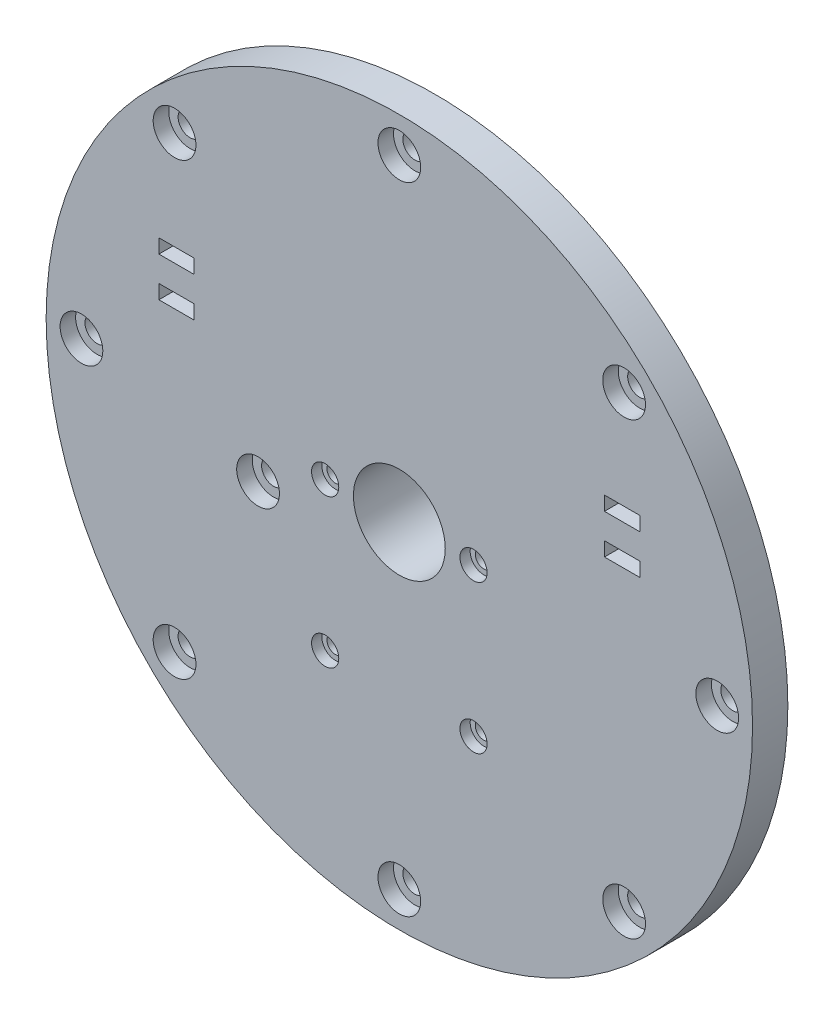
from build123d import *

# Parameters (mm, degrees)
SKETCH_1_R                   = 50
EXTRUDE_1_DEPTH              = 5
SKETCH_13_W                  = 26
SKETCH_13_H                  = 32.5
EXTRUDE_3_DEPTH              = 10
FILLET_2_R                   = 2.5
SKETCH_6_R                   = 6.5
CUT_EXTRUDE_1_DEPTH          = 73.284161474
HOLE_WIZARD_M2_1_D           = 2.4
HOLE_WIZARD_M2_1_CBORE_D     = 3.85
HOLE_WIZARD_M2_1_CBORE_DEPTH = 1.45
HOLE_WIZARD_M3_2_D           = 3.4
HOLE_WIZARD_M3_2_CBORE_D     = 6.05
HOLE_WIZARD_M3_2_CBORE_DEPTH = 2.2
PATTERN_CIRCULAR_1_COUNT     = 8
SKETCH_7_W                   = 3
SKETCH_7_H                   = 3
EXTRUDE_2_DEPTH              = 3
FILLET_1_R                   = 1
FILLET_1_OF_MIRROR_2_R       = 1
SKETCH_9_W                   = 5
SKETCH_9_H                   = 2
CUT_EXTRUDE_2_DEPTH          = 72.414284285
HOLE_WIZARD_M3_3_D           = 3.4
HOLE_WIZARD_M3_3_CBORE_D     = 6.05
HOLE_WIZARD_M3_3_CBORE_DEPTH = 2.2


with BuildPart() as part:
    # ｽｹｯﾁ1 → ﾎﾞｽ - 押し出し1 (new body)
    with BuildSketch(Plane.XY):
        Circle(SKETCH_1_R)
    extrude(amount=EXTRUDE_1_DEPTH)

    # ｽｹｯﾁ13 → ﾎﾞｽ - 押し出し3 (add)
    with BuildSketch(Plane(origin=(0, 0, 0), x_dir=(-1, 0, 0), z_dir=(0, 0, -1))):
        with Locations((0, -7.25)):
            Rectangle(SKETCH_13_W, SKETCH_13_H)
    extrude(amount=EXTRUDE_3_DEPTH)

    # ﾌｨﾚｯﾄ2
    fillet_2_edges = [part.edges().sort_by_distance(p)[0] for p in [
        (13, 9, -5),
        (13, -23.5, -5),
        (-13, -23.5, -5),
        (-13, 9, -5),
    ]]
    fillet(fillet_2_edges, radius=FILLET_2_R)

    # ｽｹｯﾁ6 → ｶｯﾄ - 押し出し1 (cut, through all)
    with BuildSketch(Plane.XY.offset(5)):
        Circle(SKETCH_6_R)
    extrude(amount=-CUT_EXTRUDE_1_DEPTH, mode=Mode.SUBTRACT)

    # M2 丸平ねじ用座ぐり穴1 (through all)
    with Locations(Plane.XY.offset(5)):
        with Locations((-10.5, 0), (-10.5, -21)):
            hole_wizard_m2_1 = CounterBoreHole(HOLE_WIZARD_M2_1_D / 2, HOLE_WIZARD_M2_1_CBORE_D / 2, HOLE_WIZARD_M2_1_CBORE_DEPTH)

    # ﾐﾗｰ1: M2 丸平ねじ用座ぐり穴1 across plane
    add(hole_wizard_m2_1.mirror(Plane(origin=(0, 0, 0), x_dir=(0, 0, 1), z_dir=(1, 0, 0))), mode=Mode.SUBTRACT)

    # M3 丸平ねじ用座ぐり穴2 (through all)
    with Locations(Plane.XY.offset(5)):
        with Locations((45, 0)):
            hole_wizard_m3_2 = CounterBoreHole(HOLE_WIZARD_M3_2_D / 2, HOLE_WIZARD_M3_2_CBORE_D / 2, HOLE_WIZARD_M3_2_CBORE_DEPTH)

    # 円形ﾊﾟﾀｰﾝ1: M3 丸平ねじ用座ぐり穴2 ×8 about axis
    pattern_circular_1_axis = Axis((0, 0, 0), (0, 0, 1))
    for i in range(1, PATTERN_CIRCULAR_1_COUNT):
        add(hole_wizard_m3_2.rotate(pattern_circular_1_axis, i * 360 / PATTERN_CIRCULAR_1_COUNT), mode=Mode.SUBTRACT)

    # ｽｹｯﾁ7 → ﾎﾞｽ - 押し出し2 (add)
    with BuildSketch(Plane(origin=(0, 0, 0), x_dir=(-1, 0, 0), z_dir=(0, 0, -1))):
        with Locations((36.535, 14.75)):
            Rectangle(SKETCH_7_W, SKETCH_7_H)
    extrude_2 = extrude(amount=EXTRUDE_2_DEPTH)

    # ﾌｨﾚｯﾄ1
    fillet_1_edges = [part.edges().sort_by_distance(p)[0] for p in [
        (-38.035, 14.75, 0),
    ]]
    fillet(fillet_1_edges, radius=FILLET_1_R)

    # ﾐﾗｰ2: ﾎﾞｽ - 押し出し2 across plane
    add(extrude_2.mirror(Plane(origin=(0, 0, 0), x_dir=(0, 0, 1), z_dir=(1, 0, 0))))

    # ﾌｨﾚｯﾄ1 of ﾐﾗｰ2
    fillet_1_of_mirror_2_edges = [part.edges().sort_by_distance(p)[0] for p in [
        (38.035, 14.75, 0),
    ]]
    fillet(fillet_1_of_mirror_2_edges, radius=FILLET_1_OF_MIRROR_2_R)

    # ｽｹｯﾁ9 → ｶｯﾄ - 押し出し2 (cut, through all)
    with BuildSketch(Plane(origin=(0, 0, 0), x_dir=(-1, 0, 0), z_dir=(0, 0, -1))):
        with Locations((31.535, 16.85)):
            Rectangle(SKETCH_9_W, SKETCH_9_H)
        with Locations((31.535, 11.25)):
            Rectangle(SKETCH_9_W, SKETCH_9_H)
    cut_extrude_2 = extrude(amount=-CUT_EXTRUDE_2_DEPTH, mode=Mode.SUBTRACT)

    # ﾐﾗｰ3: ｶｯﾄ - 押し出し2 across plane
    add(cut_extrude_2.mirror(Plane(origin=(0, 0, 0), x_dir=(0, 0, 1), z_dir=(1, 0, 0))), mode=Mode.SUBTRACT)

    # M3 丸平ねじ用座ぐり穴3 (through all)
    with Locations(Plane.XY.offset(5)):
        with Locations((-20, -5)):
            CounterBoreHole(HOLE_WIZARD_M3_3_D / 2, HOLE_WIZARD_M3_3_CBORE_D / 2, HOLE_WIZARD_M3_3_CBORE_DEPTH)


solid = part.part
